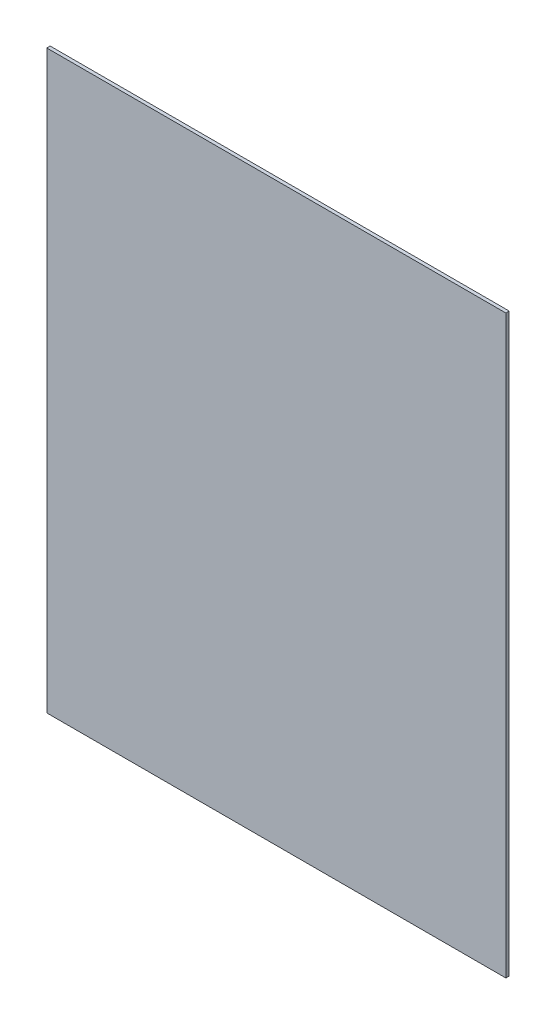
from build123d import *

# Parameters (mm, degrees)
SKETCH1_W           = 430.276
SKETCH1_H           = 539.75
BOSS_EXTRUDE1_DEPTH = 3.175


with BuildPart() as part:
    # Sketch1 → Boss-Extrude1 (new body)
    with BuildSketch(Plane.XY):
        with Locations((215.138, 269.875)):
            Rectangle(SKETCH1_W, SKETCH1_H)
    extrude(amount=BOSS_EXTRUDE1_DEPTH)


solid = part.part
